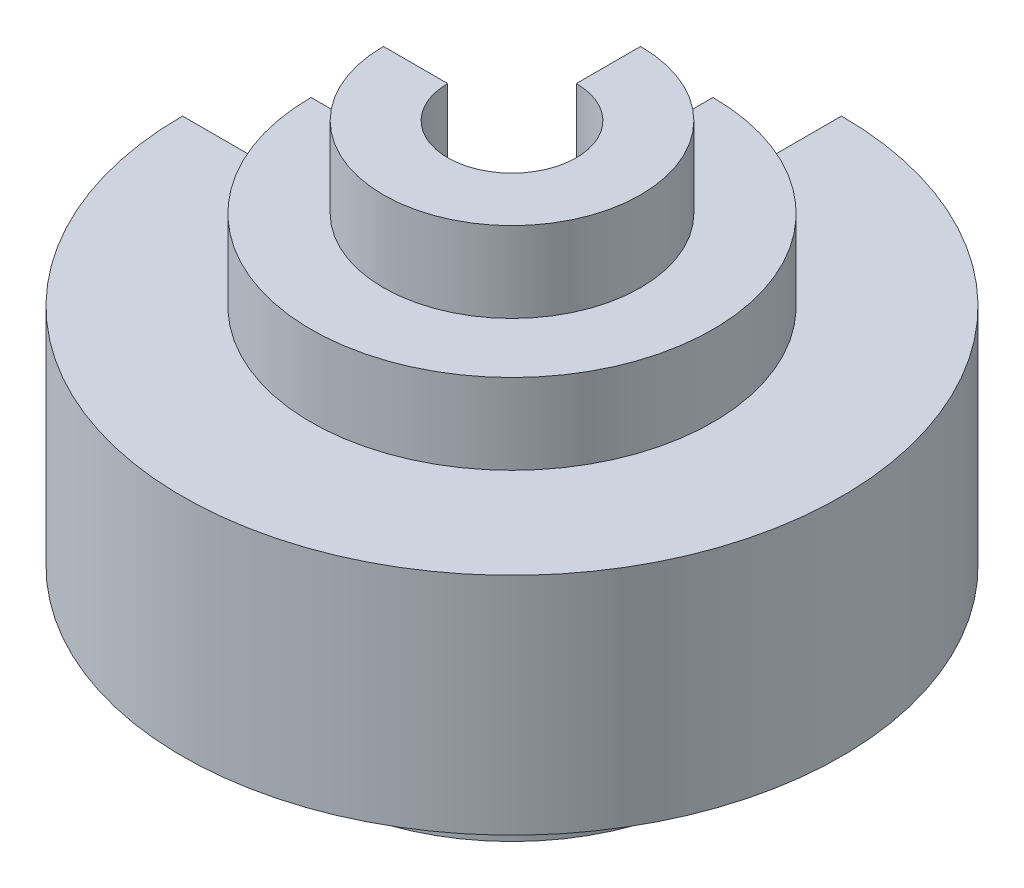
from build123d import *

# Parameters (mm, degrees)
REVOLVE1_ANGLE = 270


with BuildPart() as part:
    # Sketch1 → Revolve1 (revolve)
    with BuildSketch(Plane.XY):
        Polygon((-40, 192.728692059), (-80, 192.728692059), (-80, 142.728692059), (-125, 142.728692059), (-125, 92.728692059), (-205, 92.728692059), (-205, -47.271307941), (-125, -47.271307941), (-125, -107.271307941), (-60, -107.271307941), (-60, -7.271307941), (-155, -7.271307941), (-155, 57.728692059), (-75, 57.728692059), (-75, 107.728692059), (-40, 107.728692059), align=None)
    revolve(axis=Axis((0, -107.271307941, 0), (0, 1, 0)), revolution_arc=REVOLVE1_ANGLE)


solid = part.part
